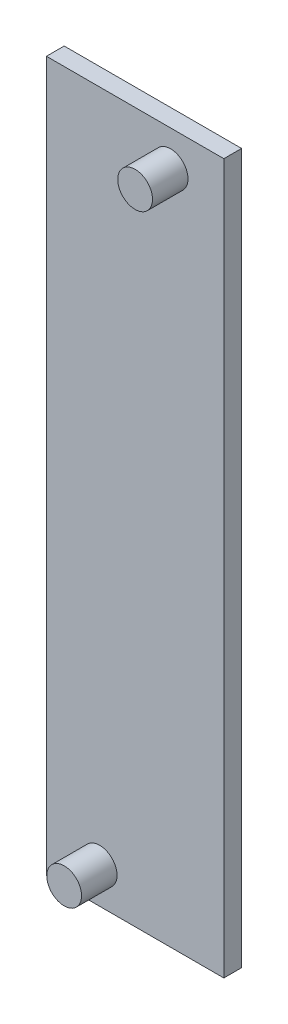
from build123d import *

# Parameters (mm, degrees)
SKETCH1_W           = 50
SKETCH1_H           = 200
BOSS_EXTRUDE1_DEPTH = 5
SKETCH2_R           = 4.9
BOSS_EXTRUDE2_DEPTH = 10


with BuildPart() as part:
    # Sketch1 → Boss-Extrude1 (new body)
    with BuildSketch(Plane.XY):
        with Locations((25, 100)):
            Rectangle(SKETCH1_W, SKETCH1_H)
    extrude(amount=BOSS_EXTRUDE1_DEPTH)

    # Sketch2 → Boss-Extrude2 (add)
    with BuildSketch(Plane.XY.offset(5)):
        with Locations(Location((15, 10, 0), (0, 0, 180))):
            Circle(SKETCH2_R)
        with Locations(Location((35, 190, 0), (0, 0, 180))):
            Circle(SKETCH2_R)
    extrude(amount=BOSS_EXTRUDE2_DEPTH)


solid = part.part
